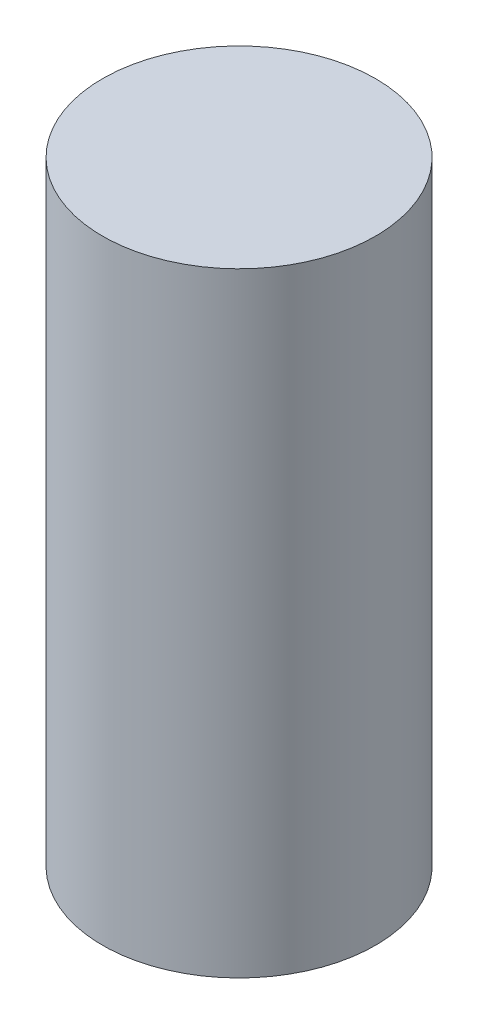
from build123d import *

# Parameters (mm, degrees)
SKETCH1_R           = 40
BOSS_EXTRUDE1_DEPTH = 180


with BuildPart() as part:
    # Sketch1 → Boss-Extrude1 (new body)
    with BuildSketch(Plane(origin=(0, 0, 0), x_dir=(1, 0, 0), z_dir=(0, 1, 0))):
        with Locations(Location((0, 0, 0), (0, 0, 90))):
            Circle(SKETCH1_R)
    extrude(amount=BOSS_EXTRUDE1_DEPTH)


solid = part.part
